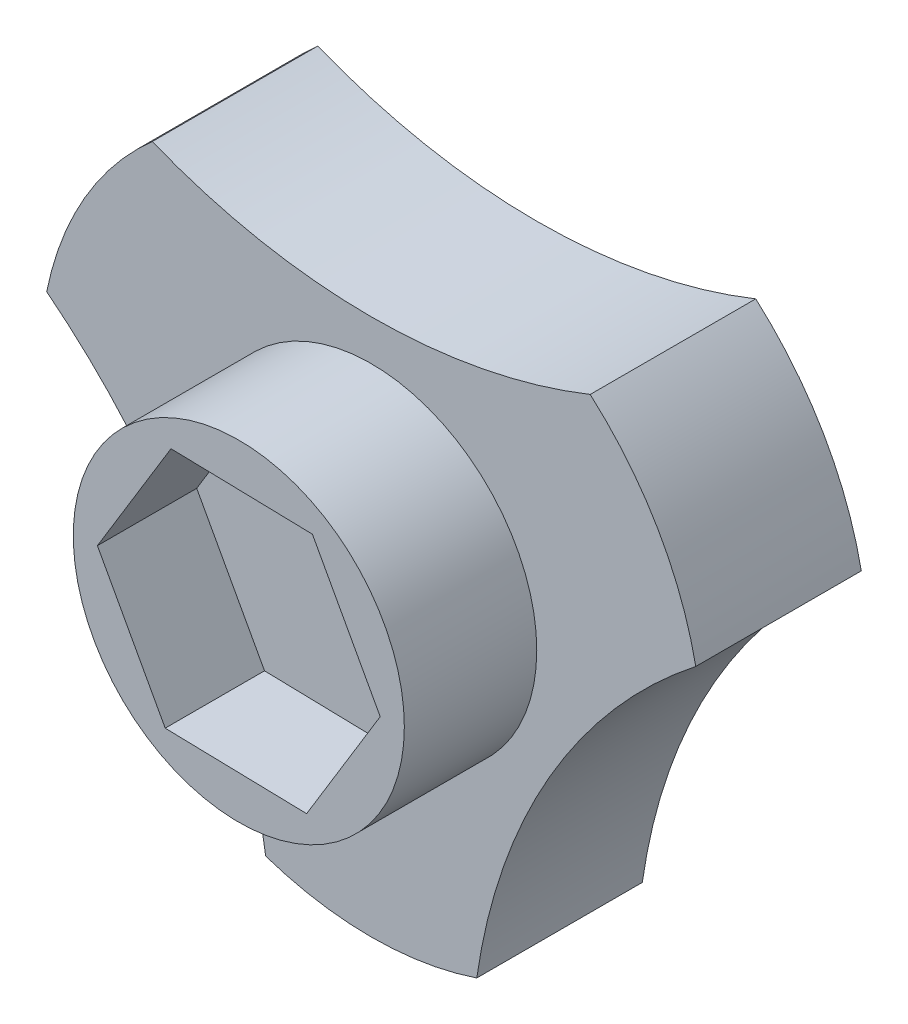
from build123d import *

# Parameters (mm, degrees)
SKETCH1_R               = 10
BOSS_EXTRUDE1_DEPTH     = 5
SKETCH2_R               = 5
BOSS_EXTRUDE2_DEPTH     = 4
CUT_EXTRUDE1_DEPTH      = 3
CUT_EXTRUDE_THIN1_DEPTH = 5


with BuildPart() as part:
    # Sketch1 → Boss-Extrude1 (new body)
    with BuildSketch(Plane.XY):
        Circle(SKETCH1_R)
    extrude(amount=BOSS_EXTRUDE1_DEPTH)

    # Sketch2 → Boss-Extrude2 (add)
    with BuildSketch(Plane.XY.offset(5)):
        Circle(SKETCH2_R)
    extrude(amount=BOSS_EXTRUDE2_DEPTH)

    # Sketch3 → Cut-Extrude1 (cut)
    with BuildSketch(Plane.XY.offset(9)):
        Polygon((2.048231561, -3.749410728), (4.27120072, -0.1008848), (2.222969159, 3.648525928), (-2.048231561, 3.749410728), (-4.27120072, 0.1008848), (-2.222969159, -3.648525928), align=None)
    extrude(amount=-CUT_EXTRUDE1_DEPTH, mode=Mode.SUBTRACT)

    # Sketch4 → Cut-Extrude-Thin1 (cut)
    with BuildSketch(Plane.XY.offset(5)):
        with BuildLine():
            ThreePointArc((-6.614378278, 7.5), (0, 6.223611165), (6.614378278, 7.5))
            Line((6.614378278, 7.5), (2.893499791, 16.781975183))
            ThreePointArc((2.893499791, 16.781975183), (0, 16.223611165), (-2.893499791, 16.781975183))
            Line((-2.893499791, 16.781975183), (-6.614378278, 7.5))
        make_face()
        with BuildLine():
            ThreePointArc((9.802379667, 1.978219619), (5.389805372, -3.111805583), (3.18800139, -9.478219619))
            Line((3.18800139, -9.478219619), (13.086866938, -10.896831917))
            ThreePointArc((13.086866938, -10.896831917), (14.05005941, -8.111805583), (15.98036673, -5.885143266))
            Line((15.98036673, -5.885143266), (9.802379667, 1.978219619))
        make_face()
        with BuildLine():
            ThreePointArc((-3.18800139, -9.478219619), (-5.389805372, -3.111805583), (-9.802379667, 1.978219619))
            Line((-9.802379667, 1.978219619), (-15.98036673, -5.885143266))
            ThreePointArc((-15.98036673, -5.885143266), (-14.05005941, -8.111805583), (-13.086866938, -10.896831917))
            Line((-13.086866938, -10.896831917), (-3.18800139, -9.478219619))
        make_face()
    extrude(amount=-CUT_EXTRUDE_THIN1_DEPTH, mode=Mode.SUBTRACT)


solid = part.part
